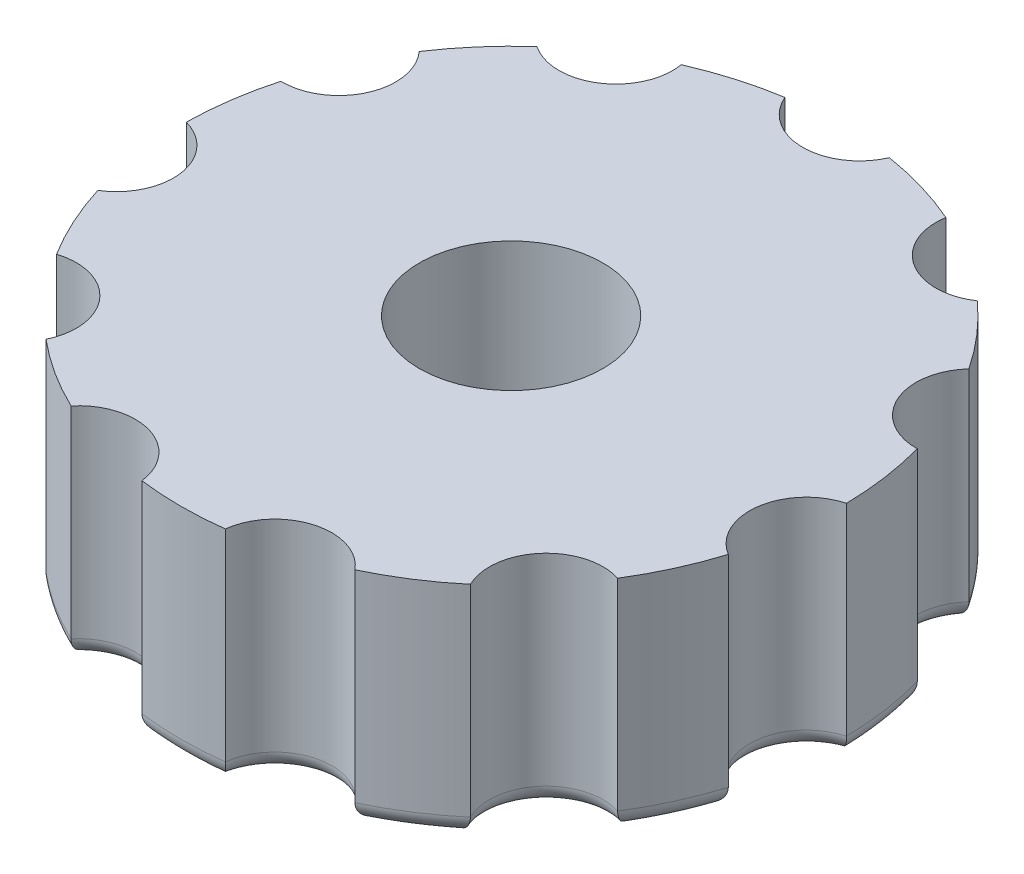
from build123d import *

# Parameters (mm, degrees)
SKETCH1_R           = 9
SKETCH1_R_2         = 2.5
BOSS_EXTRUDE1_DEPTH = 6
SKETCH1_3_R         = 2.5
BOSS_EXTRUDE2_DEPTH = 2
SKETCH1_4_R         = 1.55
CUT_EXTRUDE1_DEPTH  = 15.071247279
CIRPATTERN1_COUNT   = 11
FILLET1_R           = 0.5


with BuildPart() as part:
    # Sketch1 → Boss-Extrude1 (new body)
    with BuildSketch(Plane(origin=(0, 0, 0), x_dir=(1, 0, 0), z_dir=(0, 1, 0))):
        Circle(SKETCH1_R)
        Circle(SKETCH1_R_2, mode=Mode.SUBTRACT)
    extrude(amount=BOSS_EXTRUDE1_DEPTH)

    # Sketch1<3> → Boss-Extrude2 (add)
    with BuildSketch(Plane(origin=(0, 0, 0), x_dir=(1, 0, 0), z_dir=(0, 1, 0))):
        Circle(SKETCH1_3_R)
    extrude(amount=BOSS_EXTRUDE2_DEPTH)

    # Sketch1<4> → Cut-Extrude1 (cut, through all)
    with BuildSketch(Plane(origin=(0, 0, 0), x_dir=(1, 0, 0), z_dir=(0, 1, 0))):
        with Locations((0, 9.5)):
            Circle(SKETCH1_4_R)
    cut_extrude1 = extrude(amount=CUT_EXTRUDE1_DEPTH, mode=Mode.SUBTRACT)

    # CirPattern1: Cut-Extrude1 ×11 about axis
    cirpattern1_axis = Axis((0, 0, 0), (0, 1, 0))
    for i in range(1, CIRPATTERN1_COUNT):
        add(cut_extrude1.rotate(cirpattern1_axis, i * 360 / CIRPATTERN1_COUNT), mode=Mode.SUBTRACT)

    # Fillet1
    fillet1_edges = [part.edges().sort_by_distance(p)[0] for p in [
        (-8.908392977, 0, -1.280833544),
        (-7.869080463, 0, 1.131402964),
        (-8.186687958, 0, 3.738735117),
        (-6.008209116, 0, 5.206142835),
        (-4.865767357, 0, 7.571281795),
        (-2.239773827, 0, 7.62796914),
        (0, 0, 9),
        (2.239773827, 0, 7.62796914),
        (4.865767357, 0, 7.571281795),
        (6.008209116, 0, 5.206142835),
        (8.186687958, 0, 3.738735117),
        (0, 0, -7.95),
        (-2.535593012, 0, -8.635436763),
        (-4.298094499, 0, -6.687965586),
        (-6.801746169, 0, -5.893746606),
        (-7.231574363, 0, -3.302549353),
        (7.869080463, 0, 1.131402964),
        (8.908392977, 0, -1.280833544),
        (7.231574363, 0, -3.302549353),
        (6.801746169, 0, -5.893746606),
        (4.298094499, 0, -6.687965586),
        (2.535593012, 0, -8.635436763),
    ]]
    fillet(fillet1_edges, radius=FILLET1_R)


solid = part.part
